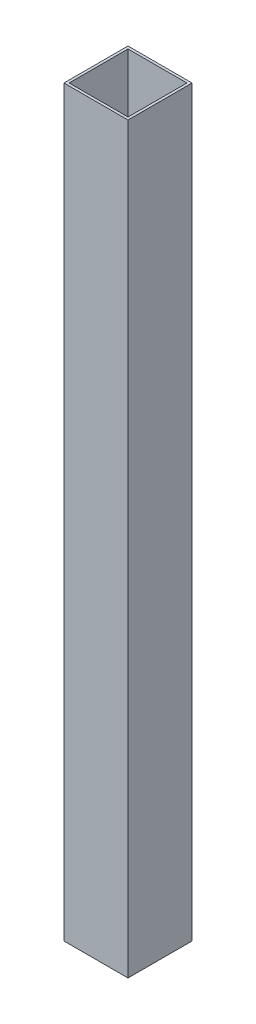
from build123d import *

# Parameters (mm, degrees)
SKETCH1_W           = 25
SKETCH1_H           = 290
BOSS_EXTRUDE1_DEPTH = 25
SKETCH2_W           = 23
SKETCH2_H           = 23
CUT_EXTRUDE1_DEPTH  = 388.351345064


with BuildPart() as part:
    # Sketch1 → Boss-Extrude1 (new body)
    with BuildSketch(Plane.XY):
        with Locations((243.070077519, -84.386109851)):
            Rectangle(SKETCH1_W, SKETCH1_H)
    extrude(amount=BOSS_EXTRUDE1_DEPTH)

    # Sketch2 → Cut-Extrude1 (cut, through all)
    with BuildSketch(Plane(origin=(0, 60.613890149, 0), x_dir=(1, 0, 0), z_dir=(0, 1, 0))):
        with Locations((243.070077519, -12.5)):
            Rectangle(SKETCH2_W, SKETCH2_H)
    extrude(amount=-CUT_EXTRUDE1_DEPTH, mode=Mode.SUBTRACT)


solid = part.part
